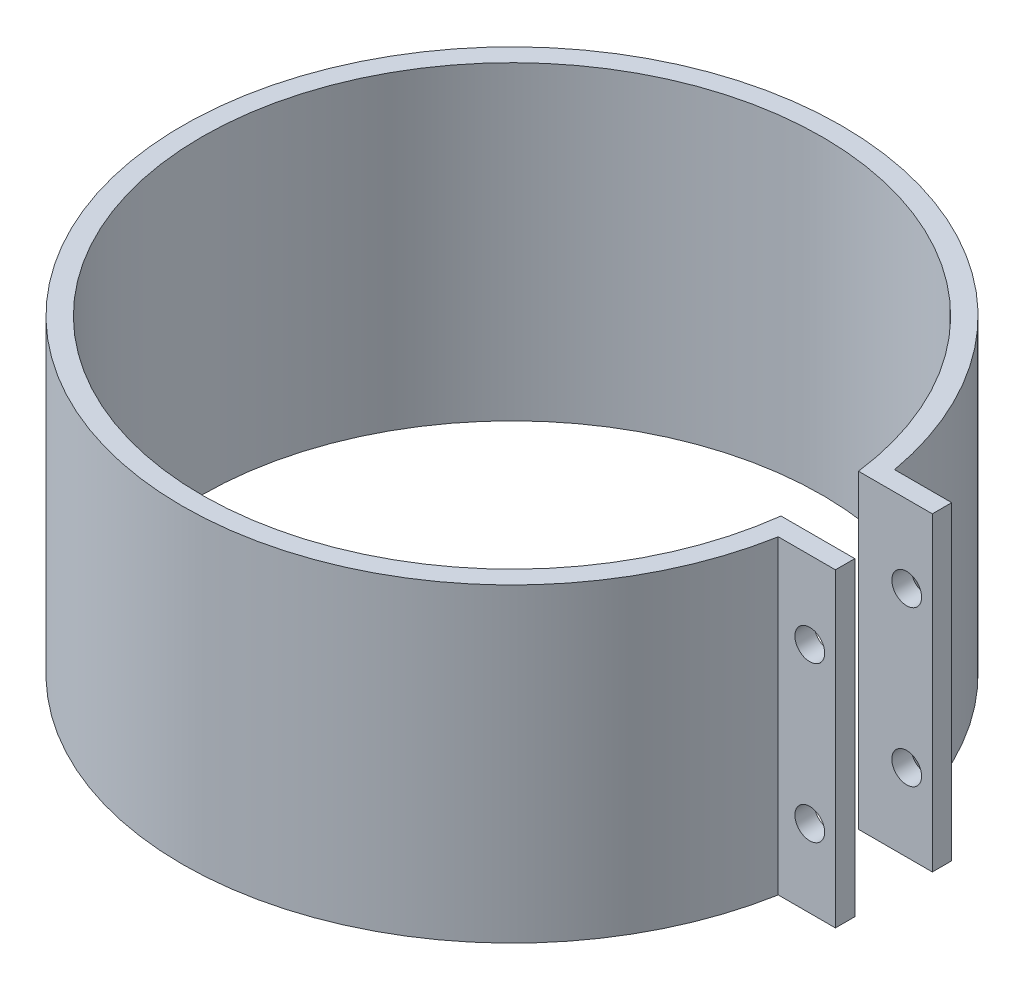
from build123d import *

# Parameters (mm, degrees)
BOSS_EXTRUDE1_DEPTH = 50.8
SKETCH3_R           = 2.4384
CUT_EXTRUDE1_DEPTH  = 103.556868279


with BuildPart() as part:
    # Sketch2 → Boss-Extrude1 (new body)
    with BuildSketch(Plane(origin=(0, 0, 0), x_dir=(1, 0, 0), z_dir=(0, 1, 0))):
        with BuildLine():
            Line((53.600169076, -6.35), (62.490169076, -6.35))
            Line((62.490169076, -6.35), (62.490169076, -9.525))
            Line((62.490169076, -9.525), (53.600169076, -9.525))
            Line((53.600169076, -9.525), (53.127911685, -9.525))
            ThreePointArc((53.127911685, -9.525), (-53.975, 0), (53.127911685, 9.525))
            Line((53.127911685, 9.525), (53.600169076, 9.525))
            Line((53.600169076, 9.525), (62.490169076, 9.525))
            Line((62.490169076, 9.525), (62.490169076, 6.35))
            Line((62.490169076, 6.35), (53.600169076, 6.35))
            Line((53.600169076, 6.35), (50.401562476, 6.35))
            ThreePointArc((50.401562476, 6.35), (-50.8, 0), (50.401562476, -6.35))
            Line((50.401562476, -6.35), (53.600169076, -6.35))
        make_face()
    extrude(amount=BOSS_EXTRUDE1_DEPTH)

    # Sketch3 → Cut-Extrude1 (cut, through all)
    with BuildSketch(Plane.XY.offset(9.525)):
        with Locations((58.292206061, 38.1)):
            Circle(SKETCH3_R)
        with Locations((58.292206061, 12.7)):
            Circle(SKETCH3_R)
    extrude(amount=-CUT_EXTRUDE1_DEPTH, mode=Mode.SUBTRACT)


solid = part.part
